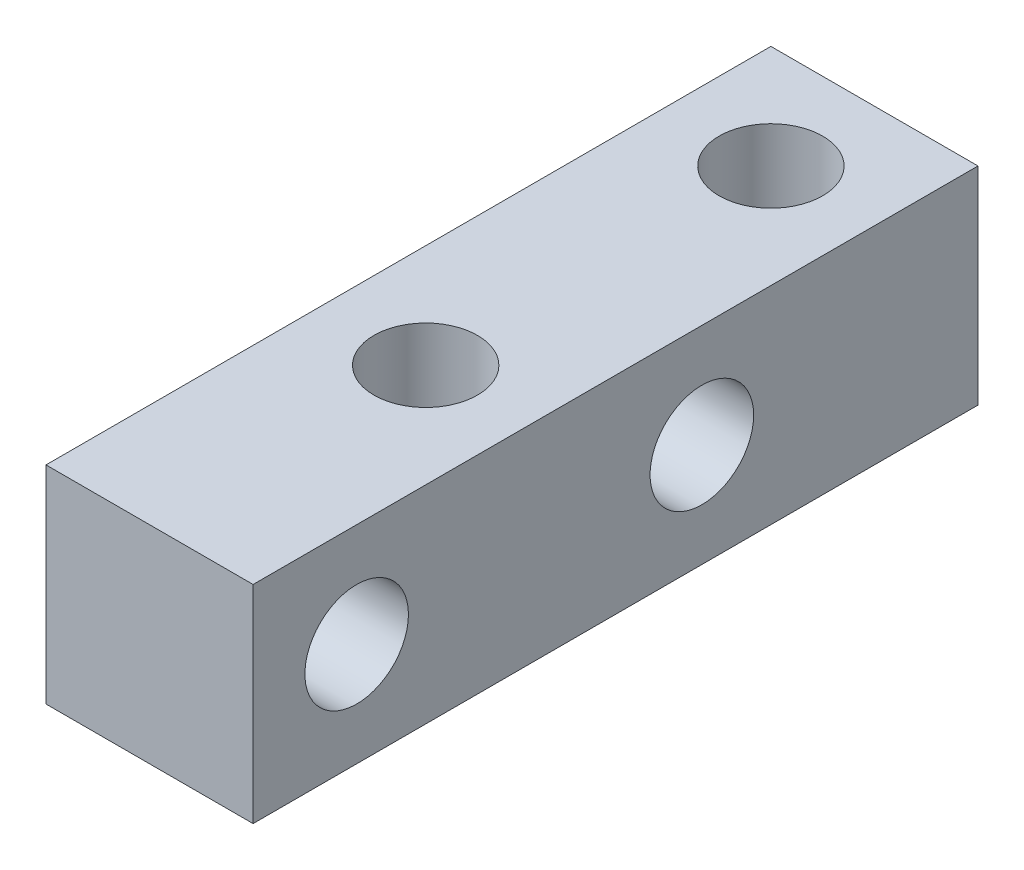
from build123d import *

# Parameters (mm, degrees)
SKETCH_1_W          = 6
SKETCH_1_H          = 6
EXTRUDE_1_DEPTH     = 21
SKETCH_2_R          = 1.5
CUT_EXTRUDE_1_DEPTH = 6
SKETCH_3_R          = 1.5
CUT_EXTRUDE_2_DEPTH = 6


with BuildPart() as part:
    # 草图1 → 凸台-拉伸1 (new body)
    with BuildSketch(Plane.XY):
        Rectangle(SKETCH_1_W, SKETCH_1_H)
    extrude(amount=EXTRUDE_1_DEPTH)

    # 草图2 → 切除-拉伸1 (cut)
    with BuildSketch(Plane(origin=(0, 3, 0), x_dir=(1, 0, 0), z_dir=(0, 1, 0))):
        with Locations(Location((0, -3, 0), (0, 0, 270))):
            Circle(SKETCH_2_R)
        with Locations(Location((0, -13, 0), (0, 0, 270))):
            Circle(SKETCH_2_R)
    extrude(amount=-CUT_EXTRUDE_1_DEPTH, mode=Mode.SUBTRACT)

    # 草图3 → 切除-拉伸2 (cut)
    with BuildSketch(Plane(origin=(3, 0, 0), x_dir=(0, 0, -1), z_dir=(1, 0, 0))):
        with Locations((-18, 0)):
            Circle(SKETCH_3_R)
        with Locations((-8, 0)):
            Circle(SKETCH_3_R)
    extrude(amount=-CUT_EXTRUDE_2_DEPTH, mode=Mode.SUBTRACT)


solid = part.part
